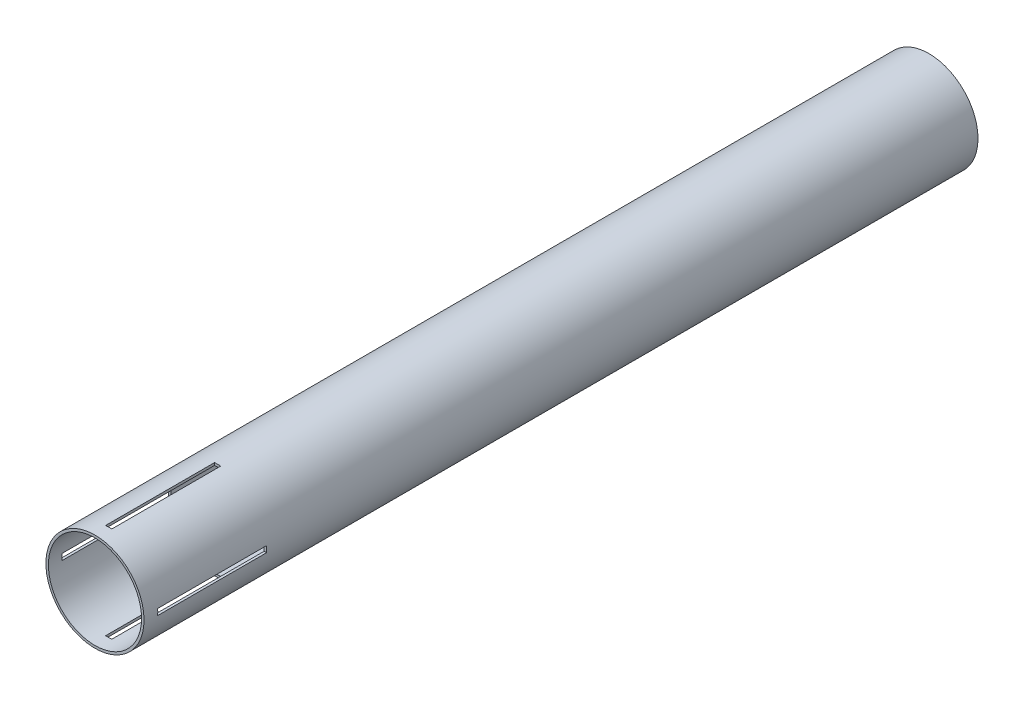
from build123d import *
from build123d.topology import SkipClean

# Parameters (mm, degrees)
SKETCH1_R           = 50.8
SKETCH1_R_2         = 48.26
BOSS_EXTRUDE1_DEPTH = 863.6
CUT_EXTRUDE1_START  = -127
CUT_EXTRUDE1_DEPTH  = 127
BOSS_EXTRUDE2_START = -14.224
BOSS_EXTRUDE2_DEPTH = 14.224


with BuildPart() as part:
    # Sketch1 → Boss-Extrude1 (new body)
    with BuildSketch(Plane.XY):
        Circle(SKETCH1_R)
        Circle(SKETCH1_R_2, mode=Mode.SUBTRACT)
    extrude(amount=BOSS_EXTRUDE1_DEPTH)

    # Sketch2 → Cut-Extrude1 (cut)
    with BuildSketch(Plane.XY.offset(863.6).offset(CUT_EXTRUDE1_START)):
        with BuildLine():
            Line((-3.175, 50.700684167), (-3.175, 48.155445954))
            ThreePointArc((-3.175, 48.155445954), (0, 48.26), (3.175, 48.155445954))
            Line((3.175, 48.155445954), (3.175, 50.700684167))
            ThreePointArc((3.175, 50.700684167), (0, 50.8), (-3.175, 50.700684167))
        make_face()
        with BuildLine():
            Line((-50.700684167, 3.175), (-48.155445954, 3.175))
            ThreePointArc((-48.155445954, 3.175), (-48.26, 0), (-48.155445954, -3.175))
            Line((-48.155445954, -3.175), (-50.700684167, -3.175))
            ThreePointArc((-50.700684167, -3.175), (-50.8, 0), (-50.700684167, 3.175))
        make_face()
        with BuildLine():
            Line((48.155445954, 3.175), (50.700684167, 3.175))
            ThreePointArc((50.700684167, 3.175), (50.8, 0), (50.700684167, -3.175))
            Line((50.700684167, -3.175), (48.155445954, -3.175))
            ThreePointArc((48.155445954, -3.175), (48.26, 0), (48.155445954, 3.175))
        make_face()
        with BuildLine():
            Line((3.175, -48.155445954), (3.175, -50.700684167))
            ThreePointArc((3.175, -50.700684167), (0, -50.8), (-3.175, -50.700684167))
            Line((-3.175, -50.700684167), (-3.175, -48.155445954))
            ThreePointArc((-3.175, -48.155445954), (0, -48.26), (3.175, -48.155445954))
        make_face()
    extrude(amount=CUT_EXTRUDE1_DEPTH, mode=Mode.SUBTRACT)

    # Sketch4 → Boss-Extrude2 (add)
    with SkipClean():  # the faces are left unmerged after this step: merging them gives an invalid solid
        with BuildSketch(Plane.XY.offset(863.6).offset(BOSS_EXTRUDE2_START)):
            with BuildLine():
                Line((-3.175, 50.700684167), (-3.175, 48.155445954))
                ThreePointArc((-3.175, 48.155445954), (0, 48.26), (3.175, 48.155445954))
                Line((3.175, 48.155445954), (3.175, 50.700684167))
                ThreePointArc((3.175, 50.700684167), (0, 50.8), (-3.175, 50.700684167))
            make_face()
            with BuildLine():
                Line((50.700684167, 3.175), (48.155445954, 3.175))
                ThreePointArc((48.155445954, 3.175), (48.26, 0), (48.155445954, -3.175))
                Line((48.155445954, -3.175), (50.700684167, -3.175))
                ThreePointArc((50.700684167, -3.175), (50.8, 0), (50.700684167, 3.175))
            make_face()
            with BuildLine():
                Line((3.175, -50.700684167), (3.175, -48.155445954))
                ThreePointArc((3.175, -48.155445954), (0, -48.26), (-3.175, -48.155445954))
                Line((-3.175, -48.155445954), (-3.175, -50.700684167))
                ThreePointArc((-3.175, -50.700684167), (0, -50.8), (3.175, -50.700684167))
            make_face()
            with BuildLine():
                Line((-48.155445954, 3.175), (-50.700684167, 3.175))
                ThreePointArc((-50.700684167, 3.175), (-50.8, 0), (-50.700684167, -3.175))
                Line((-50.700684167, -3.175), (-48.155445954, -3.175))
                ThreePointArc((-48.155445954, -3.175), (-48.26, 0), (-48.155445954, 3.175))
            make_face()
        extrude(amount=BOSS_EXTRUDE2_DEPTH)


solid = part.part
